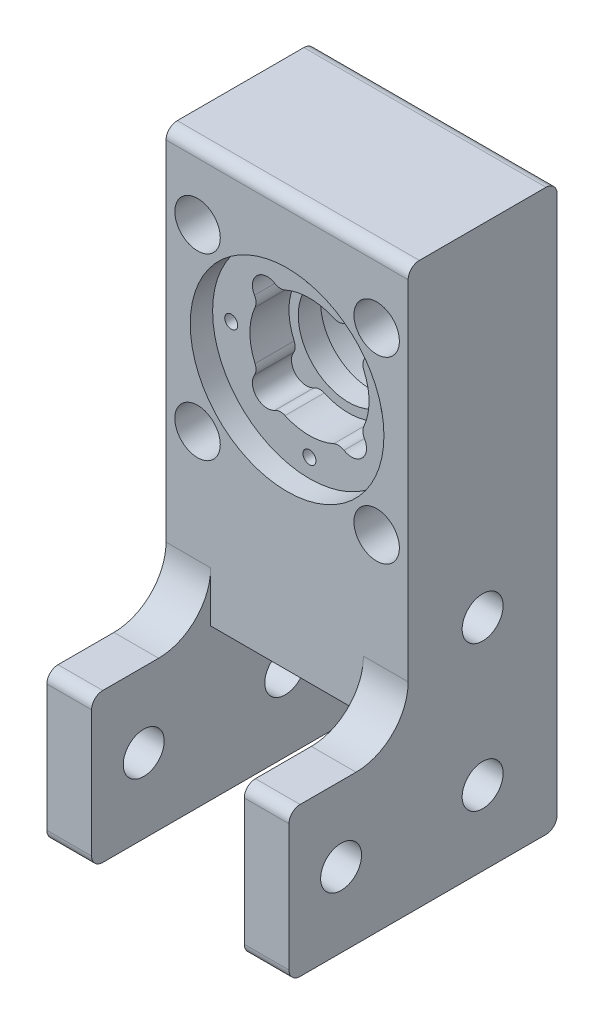
from build123d import *

# Parameters (mm, degrees)
EXTRUDE1_DEPTH      = 10.25
EXTRUDE1_DEPTH_BACK = 10.25
SKETCH1_W           = 20
SKETCH1_H           = 55
EXTRUDE2_DEPTH      = 6
SKETCH4_R           = 2.75
EXTRUDE3_DEPTH      = 78.393878957
SKETCH5_R           = 6.755
EXTRUDE4_DEPTH      = 77.273357078
FILLET2_R           = 1.5
SKETCH_1_W          = 32.5
SKETCH_1_H          = 73.75
CUT_EXTRUDE_1_DEPTH = 77.273357078
FILLET_1_R          = 1.5
SKETCH_2_R          = 13
CUT_EXTRUDE_2_DEPTH = 3
SKETCH_3_R          = 8
SKETCH_3_R_2        = 6.755
CUT_EXTRUDE_3_DEPTH = 5.25
FILLET_2_R          = 1.5
SKETCH_4_R          = 10
CUT_EXTRUDE_4_DEPTH = 8.75
SKETCH_5_R          = 0.875
CUT_EXTRUDE_5_DEPTH = 8
SKETCH_7_R          = 1.75
CUT_EXTRUDE_6_DEPTH = 71.154294238
SKETCH_8_R          = 3.05
CUT_EXTRUDE_7_DEPTH = 5


with BuildPart() as part:
    # Sketch1 → Extrude1 (new, two sides: drawn at the far end of the back side and taken through both)
    with BuildSketch(Plane(origin=(0, 0, 0), x_dir=(0, 0, -1), z_dir=(1, 0, 0)).offset(-EXTRUDE1_DEPTH_BACK)):
        with Locations((0, 37.75)):
            Rectangle(SKETCH1_W, SKETCH1_H)
    extrude(amount=EXTRUDE1_DEPTH + EXTRUDE1_DEPTH_BACK)

    # Sketch2 → Extrude2 (add)
    with BuildSketch(Plane(origin=(10.25, 0, 0), x_dir=(0, 0, -1), z_dir=(1, 0, 0))):
        with BuildLine():
            Line((26, 10), (17, 10))
            ThreePointArc((17, 10), (12.050252532, 12.050252532), (10, 17))
            Line((10, 17), (10, 65.25))
            Line((10, 65.25), (-10, 65.25))
            Line((-10, 65.25), (-10, 17))
            ThreePointArc((-10, 17), (-12.050252532, 12.050252532), (-17, 10))
            Line((-17, 10), (-26, 10))
            Line((-26, 10), (-26, -10))
            Line((-26, -10), (26, -10))
            Line((26, -10), (26, 10))
        make_face()
    extrude2 = extrude(amount=EXTRUDE2_DEPTH)

    # Mirror2: Extrude2 across plane
    add(extrude2.mirror(Plane(origin=(0, 0, 0), x_dir=(0, 0, 1), z_dir=(1, 0, 0))))

    # Sketch4 → Extrude3 (cut, through all)
    with BuildSketch(Plane(origin=(16.25, 0, 0), x_dir=(0, 0, -1), z_dir=(1, 0, 0))):
        Circle(SKETCH4_R)
        with Locations((19, 0)):
            Circle(SKETCH4_R)
        with Locations((-19, 0)):
            Circle(SKETCH4_R)
        with Locations((0, 19.5)):
            Circle(SKETCH4_R)
    extrude(amount=-EXTRUDE3_DEPTH, mode=Mode.SUBTRACT)

    # Sketch5 → Extrude4 (cut, through all)
    with BuildSketch(Plane.XY.offset(10)):
        with Locations((0, 44)):
            Circle(SKETCH5_R)
    extrude(amount=-EXTRUDE4_DEPTH, mode=Mode.SUBTRACT)

    # Fillet2
    fillet2_edges = [part.edges().sort_by_distance(p)[0] for p in [
        (13.25, 10, 26),
        (13.25, -10, 26),
        (13.25, -10, -26),
        (13.25, 10, -26),
        (-13.25, -10, 26),
        (-13.25, 10, 26),
        (-13.25, 10, -26),
        (-13.25, -10, -26),
        (0, 65.25, 10),
        (0, 65.25, -10),
    ]]
    fillet(fillet2_edges, radius=FILLET2_R)

    # Эскиз1 → Вырез-Вытянуть1 (cut, through all)
    with BuildSketch(Plane(origin=(0, 0, -10), x_dir=(-1, 0, 0), z_dir=(0, 0, -1))):
        with Locations((0, 26.875)):
            Rectangle(SKETCH_1_W, SKETCH_1_H)
    extrude(amount=CUT_EXTRUDE_1_DEPTH, mode=Mode.SUBTRACT)

    # Скругление1
    fillet_1_edges = [part.edges().sort_by_distance(p)[0] for p in [
        (-13.25, -10, -10),
        (13.25, -10, -10),
    ]]
    fillet(fillet_1_edges, radius=FILLET_1_R)

    # Эскиз2 → Вырез-Вытянуть2 (cut)
    with BuildSketch(Plane.XY.offset(10)):
        with Locations((0, 44)):
            Circle(SKETCH_2_R)
    extrude(amount=-CUT_EXTRUDE_2_DEPTH, mode=Mode.SUBTRACT)

    # Эскиз3 → Вырез-Вытянуть3 (cut)
    # profile 1 of 5: a face of its own
    with BuildSketch(Plane.XY.offset(7)):
        with Locations((0, 44)):
            Circle(SKETCH_3_R)
        with Locations((0, 44)):
            Circle(SKETCH_3_R_2, mode=Mode.SUBTRACT)
    # profile 2 of 5: a face of its own
    with BuildSketch(Plane.XY.offset(7)):
        with BuildLine():
            ThreePointArc((-6.883199074, 48.076956034), (-5.656854249, 49.656854249), (-4.076956034, 50.883199074))
            ThreePointArc((-4.076956034, 50.883199074), (-7.071067812, 51.071067812), (-6.883199074, 48.076956034))
        make_face()
    # profile 3 of 5: a face of its own
    with BuildSketch(Plane.XY.offset(7)):
        with BuildLine():
            ThreePointArc((4.076956034, 50.883199074), (5.656854249, 49.656854249), (6.883199074, 48.076956034))
            ThreePointArc((6.883199074, 48.076956034), (7.071067812, 51.071067812), (4.076956034, 50.883199074))
        make_face()
    # profile 4 of 5: a face of its own
    with BuildSketch(Plane.XY.offset(7)):
        with BuildLine():
            ThreePointArc((4.076956034, 37.116800926), (7.071067812, 36.928932188), (6.883199074, 39.923043966))
            ThreePointArc((6.883199074, 39.923043966), (5.656854249, 38.343145751), (4.076956034, 37.116800926))
        make_face()
    # profile 5 of 5: a face of its own
    with BuildSketch(Plane.XY.offset(7)):
        with BuildLine():
            ThreePointArc((-6.883199074, 39.923043966), (-7.071067812, 36.928932188), (-4.076956034, 37.116800926))
            ThreePointArc((-4.076956034, 37.116800926), (-5.656854249, 38.343145751), (-6.883199074, 39.923043966))
        make_face()
    extrude(amount=-CUT_EXTRUDE_3_DEPTH, mode=Mode.SUBTRACT)

    # Скругление2
    fillet_2_edges = [part.edges().sort_by_distance(p)[0] for p in [
        (6.883199074, 48.076956034, 4.375),
        (6.883199074, 39.923043966, 4.375),
        (4.076956034, 37.116800926, 4.375),
        (-4.076956034, 37.116800926, 4.375),
        (-6.883199074, 39.923043966, 4.375),
        (-6.883199074, 48.076956034, 4.375),
        (-4.076956034, 50.883199074, 4.375),
        (4.076956034, 50.883199074, 4.375),
    ]]
    fillet(fillet_2_edges, radius=FILLET_2_R)

    # Эскиз4 → Вырез-Вытянуть4 (cut)
    with BuildSketch(Plane(origin=(0, 0, -10), x_dir=(-1, 0, 0), z_dir=(0, 0, -1))):
        with Locations(Location((0, 44, 0), (0, 0, 90))):
            Circle(SKETCH_4_R)
    extrude(amount=-CUT_EXTRUDE_4_DEPTH, mode=Mode.SUBTRACT)

    # Эскиз5 → Вырез-Вытянуть5 (cut)
    with BuildSketch(Plane.XY.offset(7)):
        with Locations((0, 54.5)):
            Circle(SKETCH_5_R)
        with Locations((10.5, 44)):
            Circle(SKETCH_5_R)
        with Locations((0, 33.5)):
            Circle(SKETCH_5_R)
        with Locations((-10.5, 44)):
            Circle(SKETCH_5_R)
    extrude(amount=-CUT_EXTRUDE_5_DEPTH, mode=Mode.SUBTRACT)

    # Эскиз7 → Вырез-Вытянуть6 (cut, through all)
    with BuildSketch(Plane.XY.offset(10)):
        with Locations((-12.02081528, 56.02081528)):
            Circle(SKETCH_7_R)
        with Locations((12.02081528, 56.02081528)):
            Circle(SKETCH_7_R)
        with Locations((12.02081528, 31.97918472)):
            Circle(SKETCH_7_R)
        with Locations((-12.02081528, 31.97918472)):
            Circle(SKETCH_7_R)
    extrude(amount=-CUT_EXTRUDE_6_DEPTH, mode=Mode.SUBTRACT)

    # Эскиз8 → Вырез-Вытянуть7 (cut)
    with BuildSketch(Plane.XY.offset(10)):
        with Locations((-12.02081528, 56.02081528)):
            Circle(SKETCH_8_R)
        with Locations((12.02081528, 56.02081528)):
            Circle(SKETCH_8_R)
        with Locations((12.02081528, 31.97918472)):
            Circle(SKETCH_8_R)
        with Locations((-12.02081528, 31.97918472)):
            Circle(SKETCH_8_R)
    extrude(amount=-CUT_EXTRUDE_7_DEPTH, mode=Mode.SUBTRACT)


solid = part.part
